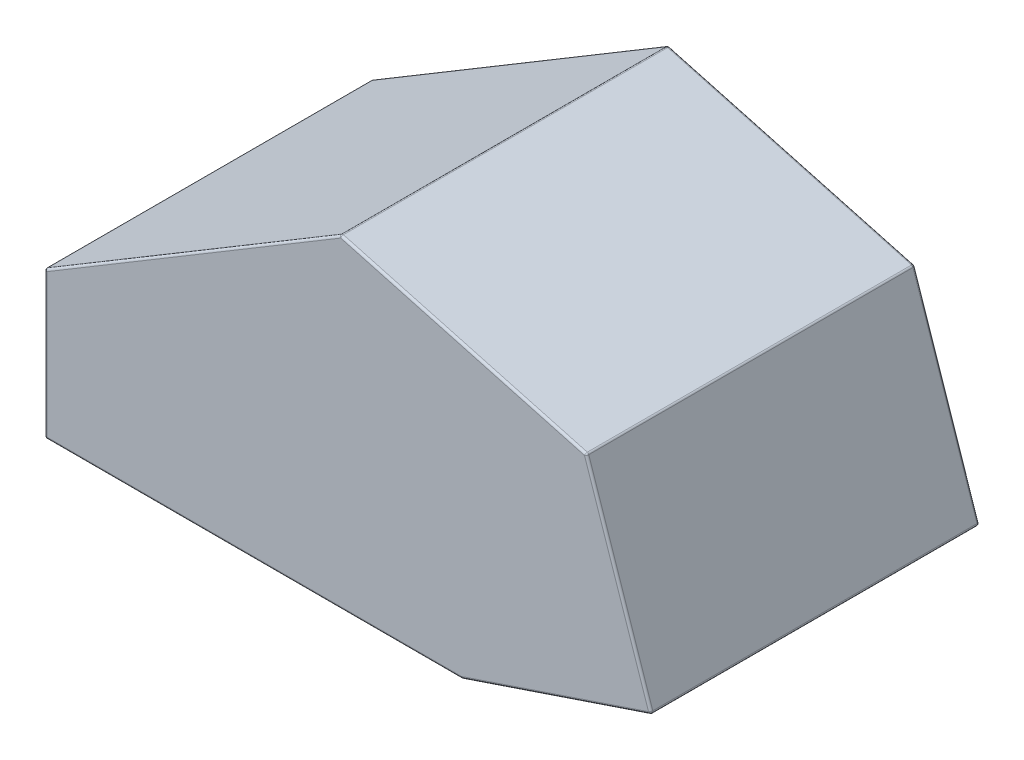
from build123d import *

# Parameters (mm, degrees)
BOSS_EXTRUDE1_DEPTH      = 19.05
BOSS_EXTRUDE1_DEPTH_BACK = 19.05
FILLET1_R                = 0.254


with BuildPart() as part:
    # Sketch1 → Boss-Extrude1 (new, two sides: drawn at the far end of the back side and taken through both)
    with BuildSketch(Plane.XY.offset(-BOSS_EXTRUDE1_DEPTH_BACK)):
        Polygon((388.793340161, 276.463831059), (354.511506684, 255.928673382), (354.511506684, 238.923904635), (402.896942526, 238.923904635), (424.852995025, 246.325755667), (417.308575132, 268.704709057), align=None)
    extrude(amount=BOSS_EXTRUDE1_DEPTH + BOSS_EXTRUDE1_DEPTH_BACK)

    # Fillet1
    fillet1_edges = [part.edges().sort_by_distance(p)[0] for p in [
        (421.080785078, 257.515232362, -19.05),
        (424.852995025, 246.325755667, 0),
        (354.511506684, 247.426289008, -19.05),
        (354.511506684, 238.923904635, 0),
        (371.652423423, 266.19625222, -19.05),
        (354.511506684, 255.928673382, 0),
        (413.874968775, 242.624830151, 19.05),
        (378.704224605, 238.923904635, 19.05),
        (354.511506684, 247.426289008, 19.05),
        (371.652423423, 266.19625222, 19.05),
        (403.050957647, 272.584270058, 19.05),
        (421.080785078, 257.515232362, 19.05),
        (402.896942526, 238.923904635, 0),
        (378.704224605, 238.923904635, -19.05),
        (403.050957647, 272.584270058, -19.05),
        (413.874968775, 242.624830151, -19.05),
        (388.793340161, 276.463831059, 0),
        (417.308575132, 268.704709057, 0),
    ]]
    fillet(fillet1_edges, radius=FILLET1_R)


solid = part.part
